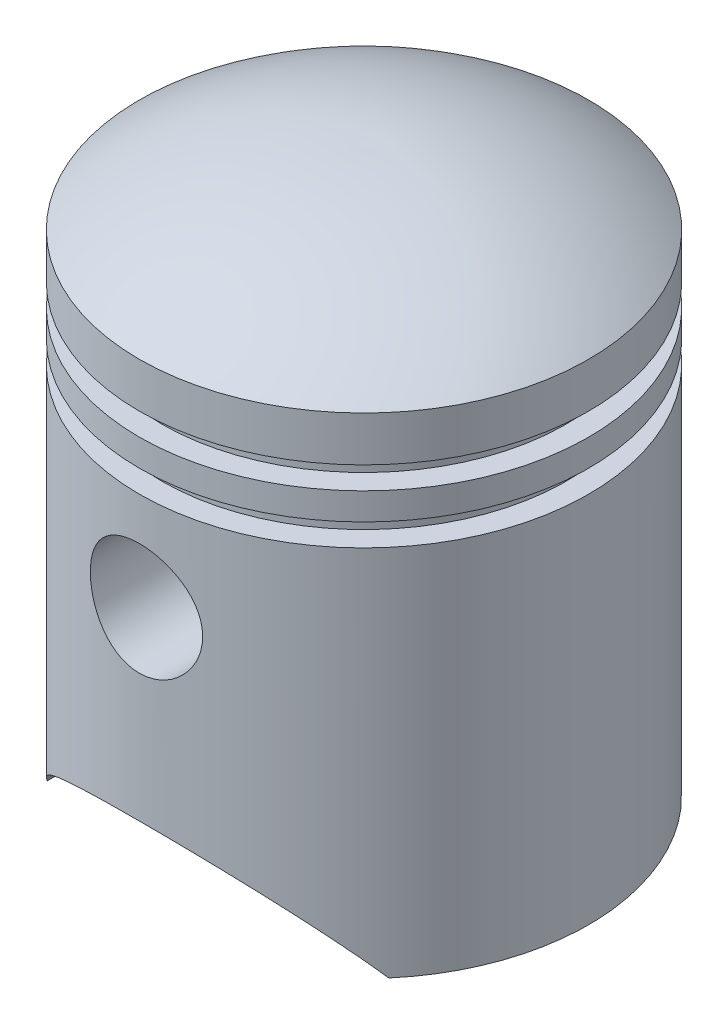
from build123d import *

# Parameters (mm, degrees)
CUT_EXTRUDE1_DEPTH       = 35
SKETCH3_R                = 6.25
CUT_EXTRUDE2_DEPTH       = 35
BOSS_EXTRUDE1_REACH      = 78.823
BOSS_EXTRUDE1_END_RADIUS = 23
SKETCH5_R                = 7.25
SKETCH5_R_2              = 6.25


with BuildPart() as part:
    # Sketch1 → Revolve1 (revolve)
    with BuildSketch(Plane.XY, mode=Mode.PRIVATE) as revolve1_sk:
        with BuildLine():
            Line((0, 62.5), (0, 60.49936285))
            ThreePointArc((0, 60.49936285), (12.069492637, 58.859165445), (23, 53.484511145))
            Line((23, 53.484511145), (23, 51.5))
            Line((23, 51.5), (20.5, 51.5))
            Line((20.5, 51.5), (20.5, 45.5))
            Line((20.5, 45.5), (20.5, 39.5))
            Line((20.5, 39.5), (23, 39.5))
            Line((23, 39.5), (23, 0))
            Line((23, 0), (25, 0))
            Line((25, 0), (25, 41.5))
            Line((25, 41.5), (22.5, 41.5))
            Line((22.5, 41.5), (22.5, 44))
            Line((22.5, 44), (25, 44))
            Line((25, 44), (25, 47))
            Line((25, 47), (22.5, 47))
            Line((22.5, 47), (22.5, 49.5))
            Line((22.5, 49.5), (25, 49.5))
            Line((25, 49.5), (25, 54.5))
            ThreePointArc((25, 54.5), (13.174901691, 60.609067785), (0, 62.5))
        make_face()
    revolve(revolve1_sk.sketch.rotate(Axis((0, 62.5, 0), (0, -1, 0)), 90), axis=Axis((0, 62.5, 0), (0, -1, 0)))

    # Sketch2 → Cut-Extrude1 (cut, symmetric)
    with BuildSketch(Plane.XY):
        with BuildLine():
            Line((-19, 0), (19, 0))
            ThreePointArc((19, 0), (0, 9.999999334), (-19, 0))
        make_face()
    extrude(amount=CUT_EXTRUDE1_DEPTH, both=True, mode=Mode.SUBTRACT)

    # Sketch3 → Cut-Extrude2 (cut, symmetric)
    with BuildSketch(Plane.XY):
        with Locations((0, 30.5)):
            Circle(SKETCH3_R)
    extrude(amount=CUT_EXTRUDE2_DEPTH, both=True, mode=Mode.SUBTRACT)

    # Boss-Extrude1: up to this cylinder (the profile starts inside it)
    boss_extrude1_end = Plane(origin=(0, 23.455061, 0), z_dir=(0, 1, 0)) * Cylinder(BOSS_EXTRUDE1_END_RADIUS, 204.646, mode=Mode.PRIVATE)
    # Sketch5 → Boss-Extrude1 (add, up to the surface)
    with BuildSketch(Plane.XY.offset(12), mode=Mode.PRIVATE) as boss_extrude1_sk1:
        with Locations(Location((0, 30.5, 0), (0, 0, 90))):
            Circle(SKETCH5_R)
        with Locations((0, 30.5)):
            Circle(SKETCH5_R_2, mode=Mode.SUBTRACT)
    boss_extrude1_tool1 = extrude(boss_extrude1_sk1.sketch, amount=BOSS_EXTRUDE1_REACH, mode=Mode.PRIVATE) & boss_extrude1_end
    boss_extrude1 = boss_extrude1_tool1.solids().sort_by_distance((0, 23.455061, 12))[0]
    add(boss_extrude1)

    # Mirror2: Boss-Extrude1 across plane
    add(boss_extrude1.mirror(Plane.XY))


solid = part.part
